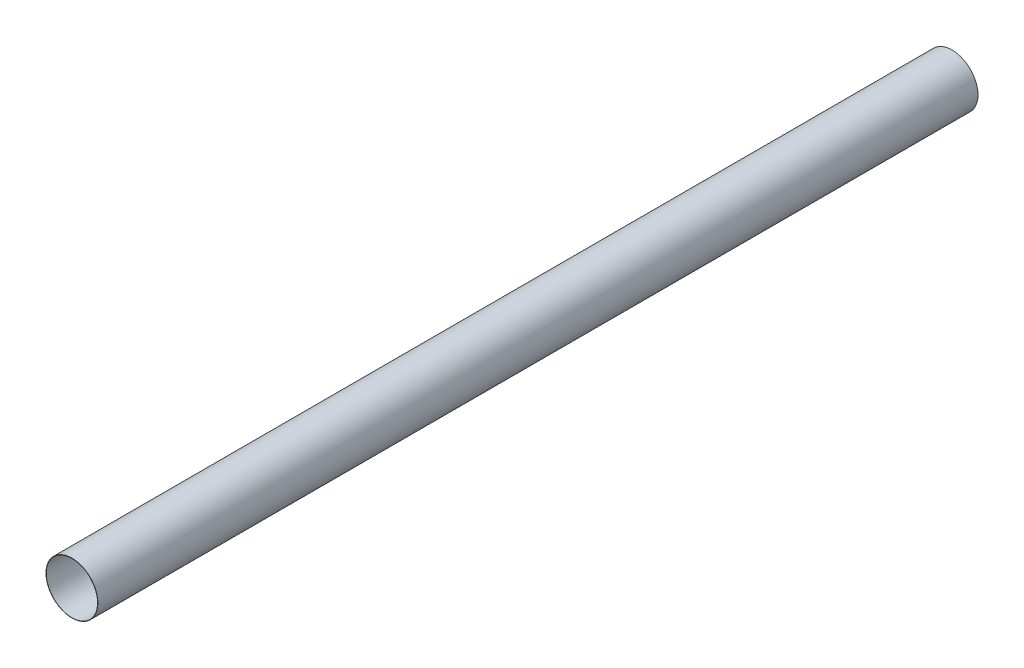
from build123d import *

# Parameters (mm, degrees)
SKETCH_1_R      = 8.85
SKETCH_1_R_2    = 8.75
EXTRUDE_1_DEPTH = 300


with BuildPart() as part:
    # 草图1 → 凸台-拉伸1 (new body)
    with BuildSketch(Plane.XY):
        Circle(SKETCH_1_R)
        Circle(SKETCH_1_R_2, mode=Mode.SUBTRACT)
    extrude(amount=EXTRUDE_1_DEPTH)


solid = part.part
